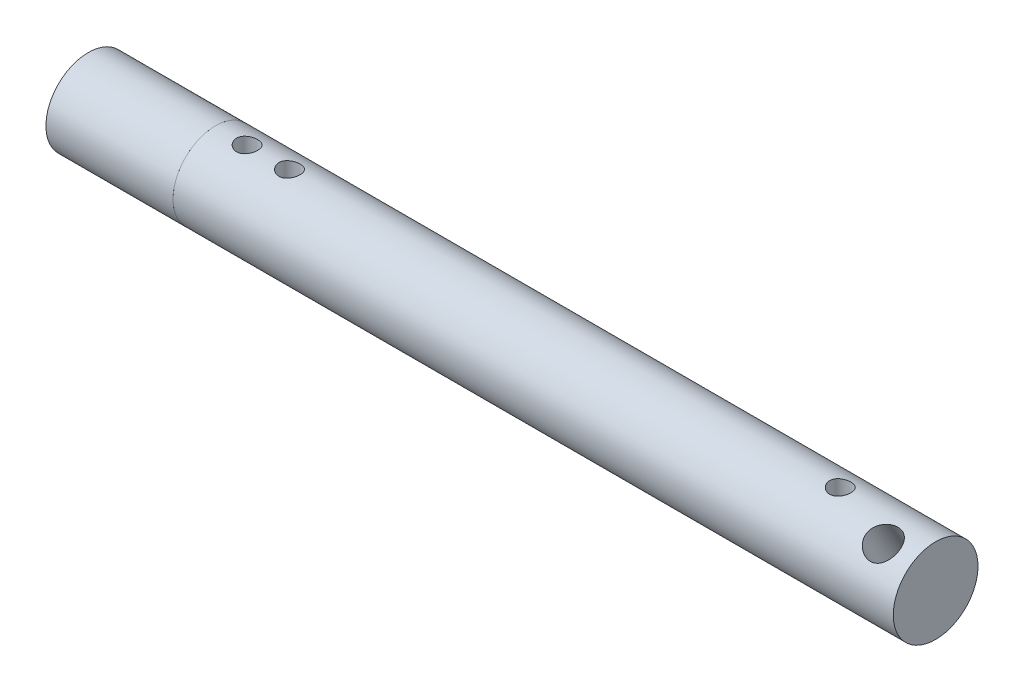
from build123d import *

# Parameters (mm, degrees)
BOSS_EXTRUDE1_DEPTH = 215.9
SKETCH2_R           = 3.175
CUT_EXTRUDE1_DEPTH  = 215.9
SKETCH3_R           = 4.7625
CUT_EXTRUDE2_DEPTH  = 215.9
SKETCH4_R           = 25.43506898
SKETCH4_R_2         = 12.7
CUT_EXTRUDE6_DEPTH  = 222.25
SKETCH5_R           = 12.7
BOSS_EXTRUDE2_DEPTH = 38.1
SKETCH6_R           = 12.7
CUT_EXTRUDE7_DEPTH  = 38.1
SKETCH7_R           = 12.7
BOSS_EXTRUDE3_DEPTH = 38.1


with BuildPart() as part:
    # Sketch1 → Boss-Extrude1 (new body)
    with BuildSketch(Plane(origin=(0, 0, 0), x_dir=(0, 0, -1), z_dir=(1, 0, 0))):
        Polygon((12.7, 3.402954744), (9.297045256, 9.297045256), (3.402954744, 12.7), (-3.402954744, 12.7), (-9.297045256, 9.297045256), (-12.7, 3.402954744), (-12.7, -3.402954744), (-9.297045256, -9.297045256), (-3.402954744, -12.7), (3.402954744, -12.7), (9.297045256, -9.297045256), (12.7, -3.402954744), align=None)
    extrude(amount=BOSS_EXTRUDE1_DEPTH)

    # Sketch2 → Cut-Extrude1 (cut)
    with BuildSketch(Plane(origin=(0, 12.7, 0), x_dir=(1, 0, 0), z_dir=(0, 1, 0))):
        with BuildLine():
            ThreePointArc((25.4, 0), (22.225, 3.175), (19.05, 0))
            Line((19.05, 0), (22.225, 0))
            Line((22.225, 0), (25.4, 0))
        make_face()
        with BuildLine():
            Line((22.225, 0), (19.05, 0))
            ThreePointArc((19.05, 0), (22.225, -3.175), (25.4, 0))
            Line((25.4, 0), (22.225, 0))
        make_face()
        with BuildLine():
            ThreePointArc((12.7, 0), (9.525, 3.175), (6.35, 0))
            Line((6.35, 0), (9.525, 0))
            Line((9.525, 0), (12.7, 0))
        make_face()
        with BuildLine():
            Line((9.525, 0), (6.35, 0))
            ThreePointArc((6.35, 0), (9.525, -3.175), (12.7, 0))
            Line((12.7, 0), (9.525, 0))
        make_face()
        with Locations(Location((187.325, 0, 0), (0, 0, 270))):
            Circle(SKETCH2_R)
    extrude(amount=-CUT_EXTRUDE1_DEPTH, mode=Mode.SUBTRACT)

    # Sketch3 → Cut-Extrude2 (cut)
    with BuildSketch(Plane(origin=(0, 10.998522628, 6.35), x_dir=(1, 0, 0), z_dir=(0, 0.8660254037844386, 0.5000000000000001))):
        with Locations(Location((206.375, 0, 0), (0, 0, 314.395209186))):
            Circle(SKETCH3_R)
    extrude(amount=-CUT_EXTRUDE2_DEPTH, mode=Mode.SUBTRACT)

    # Sketch4 → Cut-Extrude6 (cut)
    with BuildSketch(Plane.ZY):
        Circle(SKETCH4_R)
        Circle(SKETCH4_R_2, mode=Mode.SUBTRACT)
    extrude(amount=-CUT_EXTRUDE6_DEPTH, mode=Mode.SUBTRACT)


with BuildPart() as body_2:
    # Sketch5 → Boss-Extrude2 (new body)
    with BuildSketch(Plane.ZY):
        Circle(SKETCH5_R)
    extrude(amount=BOSS_EXTRUDE2_DEPTH)

    # Sketch6 → Cut-Extrude7 (cut)
    with BuildSketch(Plane.ZY.offset(38.1)):
        Circle(SKETCH6_R)
    extrude(amount=-CUT_EXTRUDE7_DEPTH, mode=Mode.SUBTRACT)


with BuildPart() as body_2_2:
    # Sketch7 → Boss-Extrude3 (new body)
    with BuildSketch(Plane.ZY):
        with Locations(Location((0, 0, 0), (0, 0, 180))):
            Circle(SKETCH7_R)
    extrude(amount=BOSS_EXTRUDE3_DEPTH)


solid = Compound([part.part, body_2_2.part])
